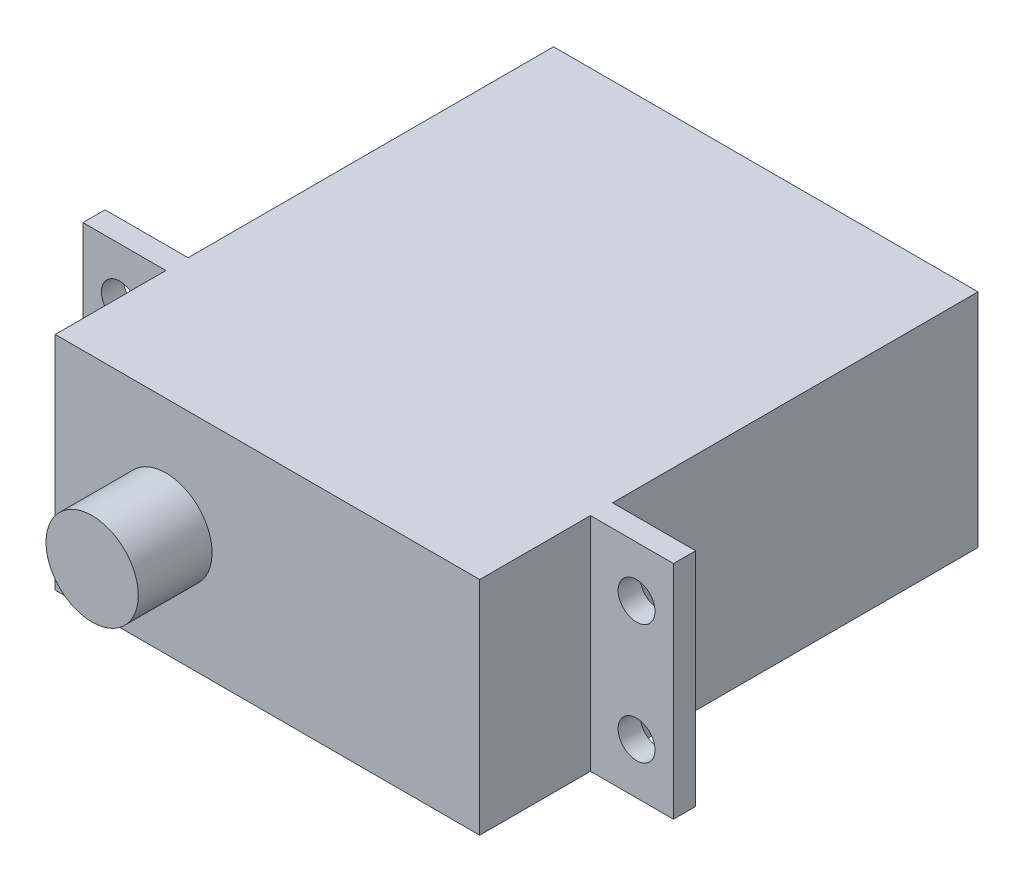
from build123d import *

# Parameters (mm, degrees)
SKETCH_2_W          = 23
SKETCH_2_H          = 12
EXTRUDE_1_DEPTH     = 27
EXTRUDE_START       = -6
SKETCH_3_W          = 32
SKETCH_3_H          = 12
EXTRUDE_2_DEPTH     = 1.2
SKETCH_4_R          = 2.5
EXTRUDE_3_DEPTH     = 4
SKETCH_5_R          = 1
CUT_EXTRUDE_1_DEPTH = 4


with BuildPart() as part:
    # 草图2 → 凸台-拉伸1 (new body)
    with BuildSketch(Plane.XY):
        Rectangle(SKETCH_2_W, SKETCH_2_H)
    extrude(amount=EXTRUDE_1_DEPTH)

    # 草图3 → 凸台-拉伸2 (add)
    with BuildSketch(Plane.XY.offset(27).offset(EXTRUDE_START)):
        Rectangle(SKETCH_3_W, SKETCH_3_H)
    extrude(amount=-EXTRUDE_2_DEPTH)

    # 草图4 → 凸台-拉伸3 (add)
    with BuildSketch(Plane.XY.offset(27)):
        with Locations(Location((-5.5, 0, 0), (0, 0, 180))):
            Circle(SKETCH_4_R)
    extrude(amount=EXTRUDE_3_DEPTH)

    # 草图5 → 切除-拉伸1 (cut)
    with BuildSketch(Plane.XY.offset(21)):
        with Locations((14, 3.25)):
            Circle(SKETCH_5_R)
        with Locations((14, -3.25)):
            Circle(SKETCH_5_R)
        with Locations((-14, -3.25)):
            Circle(SKETCH_5_R)
        with Locations((-14, 3.25)):
            Circle(SKETCH_5_R)
    extrude(amount=-CUT_EXTRUDE_1_DEPTH, mode=Mode.SUBTRACT)


solid = part.part
